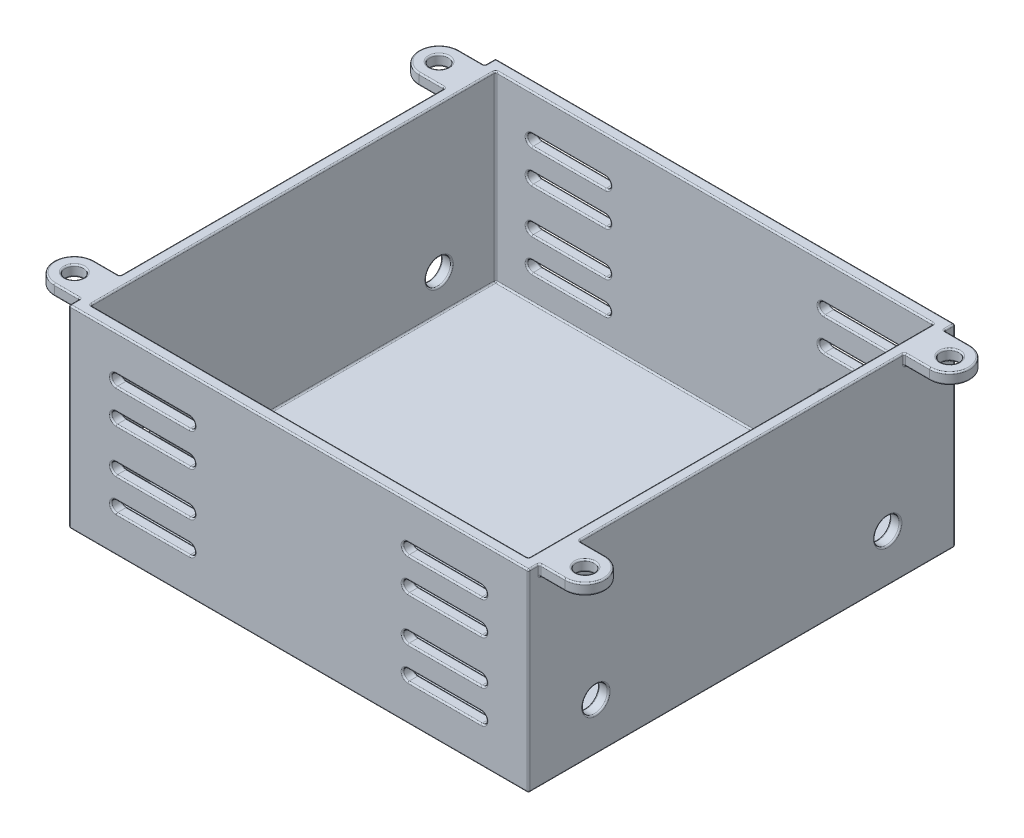
from build123d import *

# Parameters (mm, degrees)
SKETCH2_W               = 63
SKETCH2_H               = 58.5
SKETCH2_W_2             = 60
SKETCH2_H_2             = 55.5
BOSS_EXTRUDE1_DEPTH     = 25
SKETCH3_W               = 63
SKETCH3_H               = 58.5
BOSS_EXTRUDE2_DEPTH     = 1.5
SKETCH4_R               = 1.25
BOSS_EXTRUDE3_DEPTH     = 1.5
CUT_EXTRUDE1_DEPTH      = 55.61570287
CUT_EXTRUDE1_DEPTH_BACK = 55.61570287
CUT_EXTRUDE2_DEPTH      = 55.61570287
CUT_EXTRUDE2_DEPTH_BACK = 55.61570287
SKETCH6_R               = 1.75
FILLET1_R               = 0.2


with BuildPart() as part:
    # Sketch2 → Boss-Extrude1 (new body)
    with BuildSketch(Plane(origin=(0, 0, 0), x_dir=(1, 0, 0), z_dir=(0, 1, 0))):
        Rectangle(SKETCH2_W, SKETCH2_H)
        Rectangle(SKETCH2_W_2, SKETCH2_H_2, mode=Mode.SUBTRACT)
    extrude(amount=-BOSS_EXTRUDE1_DEPTH)

    # Sketch3 → Boss-Extrude2 (add)
    with BuildSketch(Plane.XZ.offset(25)):
        Rectangle(SKETCH3_W, SKETCH3_H)
    extrude(amount=BOSS_EXTRUDE2_DEPTH)

    # Sketch4 → Boss-Extrude3 (add)
    # profile 1 of 4: a face of its own
    with BuildSketch(Plane(origin=(0, 0, 0), x_dir=(1, 0, 0), z_dir=(0, 1, 0))):
        with BuildLine():
            Line((-35, 27.75), (-30, 27.75))
            Line((-30, 27.75), (-30, 22.25))
            Line((-30, 22.25), (-35, 22.25))
            ThreePointArc((-35, 22.25), (-37.75, 25), (-35, 27.75))
        make_face()
        with Locations(Location((-35, 25, 0), (0, 0, 270))):
            Circle(SKETCH4_R, mode=Mode.SUBTRACT)
    # profile 2 of 4: a face of its own
    with BuildSketch(Plane(origin=(0, 0, 0), x_dir=(1, 0, 0), z_dir=(0, 1, 0))):
        with BuildLine():
            Line((35, 22.25), (30, 22.25))
            Line((30, 22.25), (30, 27.75))
            Line((30, 27.75), (35, 27.75))
            ThreePointArc((35, 27.75), (37.75, 25), (35, 22.25))
        make_face()
        with Locations(Location((35, 25, 0), (0, 0, 270))):
            Circle(SKETCH4_R, mode=Mode.SUBTRACT)
    # profile 3 of 4: a face of its own
    with BuildSketch(Plane(origin=(0, 0, 0), x_dir=(1, 0, 0), z_dir=(0, 1, 0))):
        with BuildLine():
            Line((-35, -22.25), (-30, -22.25))
            Line((-30, -22.25), (-30, -27.75))
            Line((-30, -27.75), (-35, -27.75))
            ThreePointArc((-35, -27.75), (-37.75, -25), (-35, -22.25))
        make_face()
        with Locations(Location((-35, -25, 0), (0, 0, 270))):
            Circle(SKETCH4_R, mode=Mode.SUBTRACT)
    # profile 4 of 4: a face of its own
    with BuildSketch(Plane(origin=(0, 0, 0), x_dir=(1, 0, 0), z_dir=(0, 1, 0))):
        with BuildLine():
            Line((35, -22.25), (30, -22.25))
            Line((30, -22.25), (30, -27.75))
            Line((30, -27.75), (35, -27.75))
            ThreePointArc((35, -27.75), (37.75, -25), (35, -22.25))
        make_face()
        with Locations(Location((35, -25, 0), (0, 0, 270))):
            Circle(SKETCH4_R, mode=Mode.SUBTRACT)
    extrude(amount=-BOSS_EXTRUDE3_DEPTH)

    # Sketch5 → Cut-Extrude1 (cut, two sides: drawn at the far end of the back side and taken through both)
    with BuildSketch(Plane.XY.offset(-CUT_EXTRUDE1_DEPTH_BACK)):
        with BuildLine():
            Line((-25, -5), (-15, -5))
            ThreePointArc((-15, -5), (-14.25, -5.75), (-15, -6.5))
            Line((-15, -6.5), (-25, -6.5))
            ThreePointArc((-25, -6.5), (-25.75, -5.75), (-25, -5))
        make_face()
        with BuildLine():
            Line((-25, -9.5), (-15, -9.5))
            ThreePointArc((-15, -9.5), (-14.25, -10.25), (-15, -11))
            Line((-15, -11), (-25, -11))
            ThreePointArc((-25, -11), (-25.75, -10.25), (-25, -9.5))
        make_face()
        with BuildLine():
            Line((-25, -17), (-15, -17))
            ThreePointArc((-15, -17), (-14.25, -16.25), (-15, -15.5))
            Line((-15, -15.5), (-25, -15.5))
            ThreePointArc((-25, -15.5), (-25.75, -16.25), (-25, -17))
        make_face()
        with BuildLine():
            Line((-25, -21.5), (-15, -21.5))
            ThreePointArc((-15, -21.5), (-14.25, -20.75), (-15, -20))
            Line((-15, -20), (-25, -20))
            ThreePointArc((-25, -20), (-25.75, -20.75), (-25, -21.5))
        make_face()
        with BuildLine():
            Line((25, -21.5), (15, -21.5))
            ThreePointArc((15, -21.5), (14.25, -20.75), (15, -20))
            Line((15, -20), (25, -20))
            ThreePointArc((25, -20), (25.75, -20.75), (25, -21.5))
        make_face()
        with BuildLine():
            Line((25, -17), (15, -17))
            ThreePointArc((15, -17), (14.25, -16.25), (15, -15.5))
            Line((15, -15.5), (25, -15.5))
            ThreePointArc((25, -15.5), (25.75, -16.25), (25, -17))
        make_face()
        with BuildLine():
            Line((25, -9.5), (15, -9.5))
            ThreePointArc((15, -9.5), (14.25, -10.25), (15, -11))
            Line((15, -11), (25, -11))
            ThreePointArc((25, -11), (25.75, -10.25), (25, -9.5))
        make_face()
        with BuildLine():
            Line((25, -5), (15, -5))
            ThreePointArc((15, -5), (14.25, -5.75), (15, -6.5))
            Line((15, -6.5), (25, -6.5))
            ThreePointArc((25, -6.5), (25.75, -5.75), (25, -5))
        make_face()
    extrude(amount=CUT_EXTRUDE1_DEPTH + CUT_EXTRUDE1_DEPTH_BACK, mode=Mode.SUBTRACT)

    # Sketch6 → Cut-Extrude2 (cut, two sides: drawn at the far end of the back side and taken through both)
    with BuildSketch(Plane(origin=(0, 0, 0), x_dir=(0, 0, -1), z_dir=(1, 0, 0)).offset(-CUT_EXTRUDE2_DEPTH_BACK)):
        with Locations((-20, -20)):
            Circle(SKETCH6_R)
        with Locations((20, -20)):
            Circle(SKETCH6_R)
    extrude(amount=CUT_EXTRUDE2_DEPTH + CUT_EXTRUDE2_DEPTH_BACK, mode=Mode.SUBTRACT)

    # Fillet1
    fillet1_edges = [part.edges().sort_by_distance(p)[0] for p in [
        (31.5, 0, 0),
        (31.5, -1.5, 25),
        (37.75, -1.5, 25),
        (31.5, -0.75, 27.75),
        (33.25, -1.5, 27.75),
        (33.25, -1.5, 22.25),
        (31.5, -0.75, 22.25),
        (35, -1.5, 23.75),
        (33.25, 0, 22.25),
        (33.25, 0, 27.75),
        (37.75, 0, 25),
        (35, 0, 23.75),
        (-20, -6.5, -27.75),
        (-14.25, -5.75, -27.75),
        (-20, -5, -27.75),
        (-25.75, -5.75, -27.75),
        (20, -5, -27.75),
        (14.25, -5.75, -27.75),
        (20, -6.5, -27.75),
        (25.75, -5.75, -27.75),
        (20, -9.5, -27.75),
        (14.25, -10.25, -27.75),
        (20, -11, -27.75),
        (25.75, -10.25, -27.75),
        (20, -15.5, -27.75),
        (14.25, -16.25, -27.75),
        (20, -17, -27.75),
        (25.75, -16.25, -27.75),
        (20, -20, -27.75),
        (14.25, -20.75, -27.75),
        (20, -21.5, -27.75),
        (25.75, -20.75, -27.75),
        (-20, -21.5, -27.75),
        (-14.25, -20.75, -27.75),
        (-20, -20, -27.75),
        (-25.75, -20.75, -27.75),
        (0, -25, 27.75),
        (-20, -17, -27.75),
        (-14.25, -16.25, -27.75),
        (-20, -15.5, -27.75),
        (-25.75, -16.25, -27.75),
        (-20, -11, -27.75),
        (-14.25, -10.25, -27.75),
        (30, -12.5, 27.75),
        (-20, -9.5, -27.75),
        (-25.75, -10.25, -27.75),
        (-30, -25, 0),
        (-30, -12.5, 27.75),
        (0, -25, -27.75),
        (-30, -12.5, -27.75),
        (30, -25, 0),
        (30, -12.5, -27.75),
        (0, 0, 27.75),
        (30, 0, 0),
        (0, 0, -27.75),
        (-30, 0, 0),
        (-25.75, -10.25, 27.75),
        (-25.75, -10.25, -29.25),
        (-20, -9.5, 27.75),
        (-20, -9.5, -29.25),
        (-14.25, -10.25, 27.75),
        (-14.25, -10.25, -29.25),
        (-20, -11, 27.75),
        (-20, -11, -29.25),
        (-25.75, -10.25, 29.25),
        (-20, -11, 29.25),
        (-14.25, -10.25, 29.25),
        (-20, -9.5, 29.25),
        (-25.75, -16.25, 27.75),
        (-25.75, -16.25, -29.25),
        (-20, -15.5, 27.75),
        (-20, -15.5, -29.25),
        (-14.25, -16.25, 27.75),
        (-14.25, -16.25, -29.25),
        (-20, -17, 27.75),
        (-20, -17, -29.25),
        (-25.75, -16.25, 29.25),
        (-20, -17, 29.25),
        (-14.25, -16.25, 29.25),
        (-20, -15.5, 29.25),
        (-25.75, -20.75, 27.75),
        (-25.75, -20.75, -29.25),
        (-20, -20, 27.75),
        (-20, -20, -29.25),
        (-14.25, -20.75, 27.75),
        (-14.25, -20.75, -29.25),
        (-20, -21.5, 27.75),
        (-20, -21.5, -29.25),
        (-25.75, -20.75, 29.25),
        (-20, -21.5, 29.25),
        (-14.25, -20.75, 29.25),
        (-20, -20, 29.25),
        (25.75, -20.75, 27.75),
        (25.75, -20.75, -29.25),
        (20, -21.5, 27.75),
        (20, -21.5, -29.25),
        (14.25, -20.75, 27.75),
        (14.25, -20.75, -29.25),
        (20, -20, 27.75),
        (20, -20, -29.25),
        (25.75, -20.75, 29.25),
        (20, -20, 29.25),
        (14.25, -20.75, 29.25),
        (20, -21.5, 29.25),
        (25.75, -16.25, 27.75),
        (25.75, -16.25, -29.25),
        (20, -17, 27.75),
        (20, -17, -29.25),
        (14.25, -16.25, 27.75),
        (14.25, -16.25, -29.25),
        (20, -15.5, 27.75),
        (20, -15.5, -29.25),
        (25.75, -16.25, 29.25),
        (20, -15.5, 29.25),
        (14.25, -16.25, 29.25),
        (20, -17, 29.25),
        (25.75, -10.25, 27.75),
        (25.75, -10.25, -29.25),
        (20, -11, 27.75),
        (20, -11, -29.25),
        (14.25, -10.25, 27.75),
        (14.25, -10.25, -29.25),
        (20, -9.5, 27.75),
        (20, -9.5, -29.25),
        (25.75, -10.25, 29.25),
        (20, -9.5, 29.25),
        (14.25, -10.25, 29.25),
        (20, -11, 29.25),
        (25.75, -5.75, 27.75),
        (25.75, -5.75, -29.25),
        (20, -6.5, 27.75),
        (20, -6.5, -29.25),
        (14.25, -5.75, 27.75),
        (14.25, -5.75, -29.25),
        (20, -5, 27.75),
        (20, -5, -29.25),
        (25.75, -5.75, 29.25),
        (20, -5, 29.25),
        (14.25, -5.75, 29.25),
        (20, -6.5, 29.25),
        (-25.75, -5.75, 27.75),
        (-25.75, -5.75, -29.25),
        (-20, -5, 27.75),
        (-20, -5, -29.25),
        (-14.25, -5.75, 27.75),
        (-14.25, -5.75, -29.25),
        (-20, -6.5, 27.75),
        (-20, -6.5, -29.25),
        (-25.75, -5.75, 29.25),
        (-20, -6.5, 29.25),
        (-14.25, -5.75, 29.25),
        (-20, -5, 29.25),
        (31.5, -26.5, 0),
        (0, -26.5, 29.25),
        (-31.5, -26.5, 0),
        (0, -26.5, -29.25),
        (-31.5, -20, 21.75),
        (31.5, -20, 21.75),
        (-30, -20, 21.75),
        (30, -20, 21.75),
        (-31.5, -20, -18.25),
        (31.5, -20, -18.25),
        (-30, -20, -18.25),
        (30, -20, -18.25),
        (-31.5, 0, 0),
        (-31.5, 0, -28.5),
        (-31.5, -1.5, -25),
        (-37.75, -1.5, -25),
        (-31.5, -0.75, -27.75),
        (-33.25, -1.5, -27.75),
        (-33.25, -1.5, -22.25),
        (-31.5, -0.75, -22.25),
        (-35, -1.5, -26.25),
        (-33.25, 0, -22.25),
        (-33.25, 0, -27.75),
        (0, 0, -29.25),
        (-37.75, 0, -25),
        (-35, 0, -26.25),
        (31.5, 0, 28.5),
        (0, 0, 29.25),
        (31.5, 0, -28.5),
        (31.5, -1.5, -25),
        (37.75, -1.5, -25),
        (31.5, -0.75, -22.25),
        (33.25, -1.5, -22.25),
        (33.25, -1.5, -27.75),
        (31.5, -0.75, -27.75),
        (35, -1.5, -26.25),
        (33.25, 0, -27.75),
        (33.25, 0, -22.25),
        (37.75, 0, -25),
        (35, 0, -26.25),
        (-31.5, -13.25, 29.25),
        (-31.5, -13.25, -29.25),
        (31.5, -13.25, -29.25),
        (31.5, -13.25, 29.25),
        (-31.5, 0, 28.5),
        (-31.5, -1.5, 25),
        (-37.75, -1.5, 25),
        (-31.5, -0.75, 22.25),
        (-33.25, -1.5, 22.25),
        (-33.25, -1.5, 27.75),
        (-31.5, -0.75, 27.75),
        (-35, -1.5, 23.75),
        (-33.25, 0, 27.75),
        (-33.25, 0, 22.25),
        (-37.75, 0, 25),
        (-35, 0, 23.75),
    ]]
    fillet(fillet1_edges, radius=FILLET1_R)


solid = part.part
